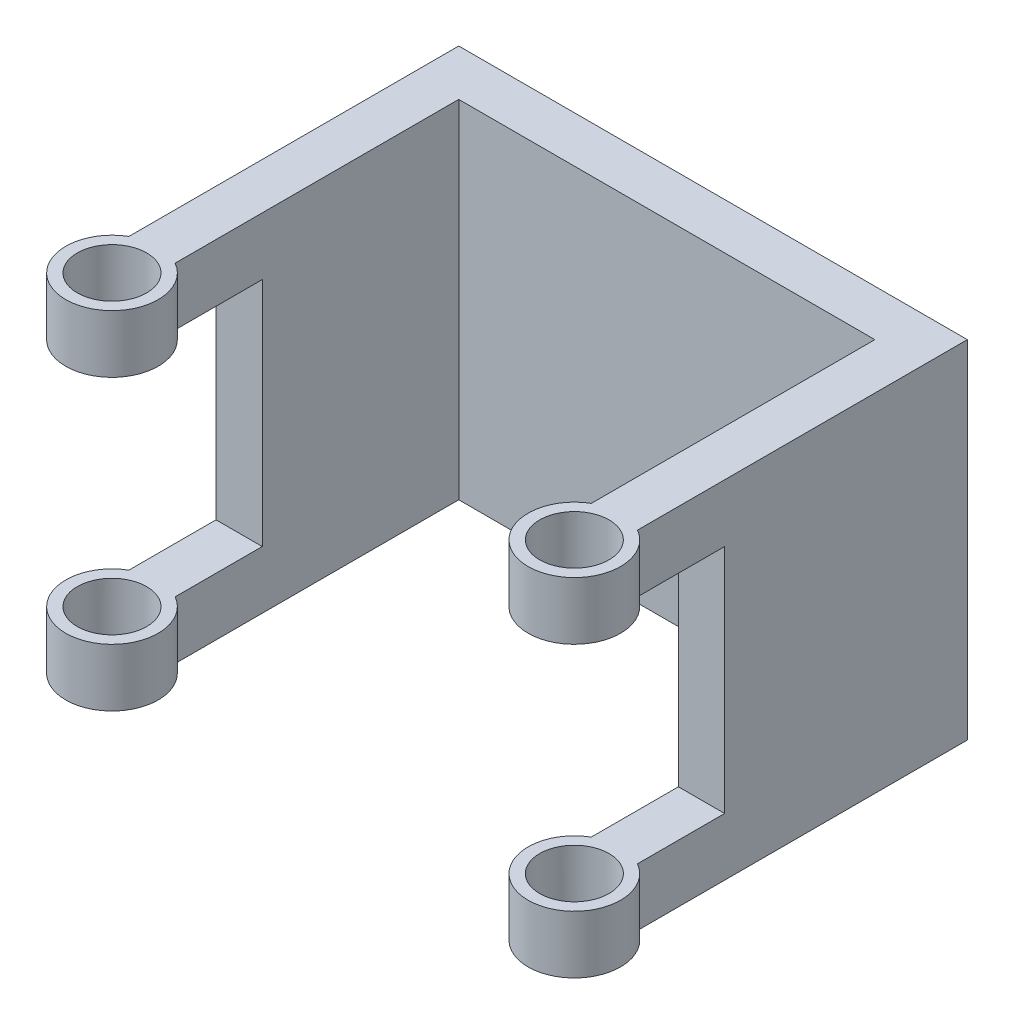
from build123d import *

# Parameters (mm, degrees)
BOSS_EXTRUDE1_DEPTH     = 15
CUT_EXTRUDE1_DEPTH      = 32.064449134
CUT_EXTRUDE1_DEPTH_BACK = 32.064449134
SKETCH2_W               = 7.5
SKETCH2_H               = 10
SKETCH3_R               = 1.5
CUT_EXTRUDE2_DEPTH      = 32.064449134


with BuildPart() as part:
    # Sketch1 → Boss-Extrude1 (new body)
    with BuildSketch(Plane(origin=(0, 0, 0), x_dir=(1, 0, 0), z_dir=(0, 1, 0))):
        with BuildLine():
            Line((1, 1.732050808), (1, 14))
            Line((1, 14), (19, 14))
            Line((19, 14), (19, 1.732050808))
            ThreePointArc((19, 1.732050808), (20, -2), (21, 1.732050808))
            Line((21, 1.732050808), (21, 16))
            Line((21, 16), (-1, 16))
            Line((-1, 16), (-1, 1.732050808))
            ThreePointArc((-1, 1.732050808), (0, -2), (1, 1.732050808))
        make_face()
    extrude(amount=BOSS_EXTRUDE1_DEPTH)

    # Sketch2 → Cut-Extrude1 (cut, two sides: drawn at the far end of the back side and taken through both)
    with BuildSketch(Plane(origin=(0, 0, 0), x_dir=(0, 0, -1), z_dir=(1, 0, 0)).offset(-CUT_EXTRUDE1_DEPTH_BACK)):
        with Locations((1.75, 7.5)):
            Rectangle(SKETCH2_W, SKETCH2_H)
    extrude(amount=CUT_EXTRUDE1_DEPTH + CUT_EXTRUDE1_DEPTH_BACK, mode=Mode.SUBTRACT)

    # Sketch3 → Cut-Extrude2 (cut, through all)
    with BuildSketch(Plane(origin=(0, 15, 0), x_dir=(1, 0, 0), z_dir=(0, 1, 0))):
        with Locations(Location((0, 0, 0), (0, 0, 270))):
            Circle(SKETCH3_R)
        with Locations(Location((20, 0, 0), (0, 0, 270))):
            Circle(SKETCH3_R)
    extrude(amount=-CUT_EXTRUDE2_DEPTH, mode=Mode.SUBTRACT)


solid = part.part
